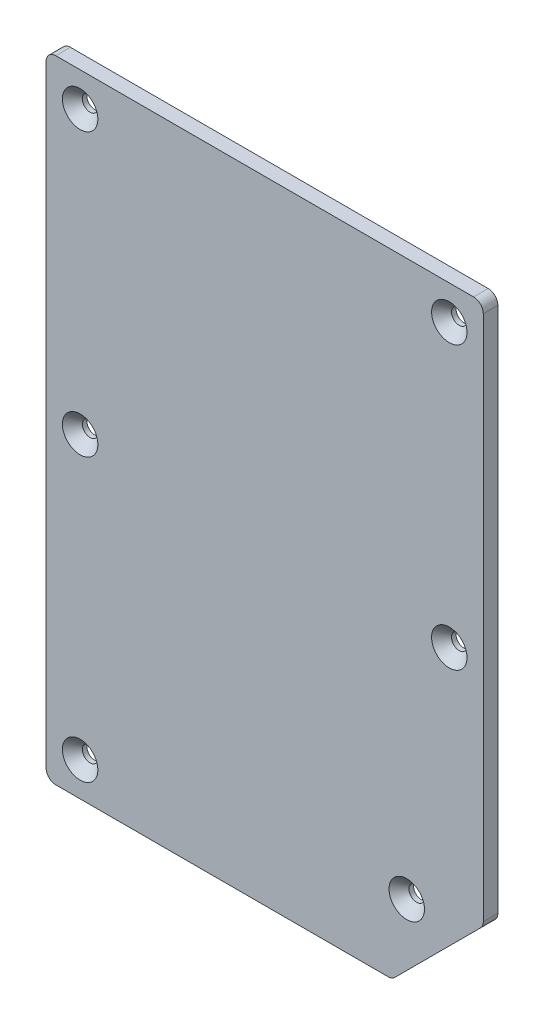
from build123d import *

# Parameters (mm, degrees)
BOSS_EXTRUDE1_DEPTH                                 = 3
CSK_FOR_M3_COUNTERSUNK_FLAT_HEAD_SCREW1_D           = 3.2
CSK_FOR_M3_COUNTERSUNK_FLAT_HEAD_SCREW1_DEPTH       = 5
CSK_FOR_M3_COUNTERSUNK_FLAT_HEAD_SCREW1_CSINK_D     = 7.3
CSK_FOR_M3_COUNTERSUNK_FLAT_HEAD_SCREW1_CSINK_ANGLE = 90
CSK_FOR_M3_COUNTERSUNK_FLAT_HEAD_SCREW1_TIP         = 0.96137699


with BuildPart() as part:
    # Sketch1 → Boss-Extrude1 (new body)
    with BuildSketch(Plane.XY):
        with BuildLine():
            Line((-43, 70), (43, 70))
            ThreePointArc((43, 70), (44.414213562, 69.414213562), (45, 68))
            Line((45, 68), (45, -40.384776311))
            ThreePointArc((45, -40.384776311), (44.847759065, -41.150143176), (44.414213562, -41.798989873))
            Line((44.414213562, -41.798989873), (26.798989873, -59.414213562))
            ThreePointArc((26.798989873, -59.414213562), (26.150143176, -59.847759065), (25.384776311, -60))
            Line((25.384776311, -60), (-43, -60))
            ThreePointArc((-43, -60), (-44.414213562, -59.414213562), (-45, -58))
            Line((-45, -58), (-45, 68))
            ThreePointArc((-45, 68), (-44.414213562, 69.414213562), (-43, 70))
        make_face()
    extrude(amount=BOSS_EXTRUDE1_DEPTH)

    # CSK for M3 Countersunk Flat Head Screw1
    with Locations(Plane(origin=(-38, -53, 3), x_dir=(1, 0, 0), z_dir=(0, 0, 1))):
        with Locations((0, 0), (67.242640687, 8.757359313), (76, 58), (0, 58), (0, 116), (76, 116)):
            CounterSinkHole(CSK_FOR_M3_COUNTERSUNK_FLAT_HEAD_SCREW1_D / 2, CSK_FOR_M3_COUNTERSUNK_FLAT_HEAD_SCREW1_CSINK_D / 2, depth=CSK_FOR_M3_COUNTERSUNK_FLAT_HEAD_SCREW1_DEPTH, counter_sink_angle=CSK_FOR_M3_COUNTERSUNK_FLAT_HEAD_SCREW1_CSINK_ANGLE)
            with Locations((0, 0, -(CSK_FOR_M3_COUNTERSUNK_FLAT_HEAD_SCREW1_DEPTH + CSK_FOR_M3_COUNTERSUNK_FLAT_HEAD_SCREW1_TIP / 2))):  # 118° drill point
                Cone(0, CSK_FOR_M3_COUNTERSUNK_FLAT_HEAD_SCREW1_D / 2, CSK_FOR_M3_COUNTERSUNK_FLAT_HEAD_SCREW1_TIP, mode=Mode.SUBTRACT)


solid = part.part
